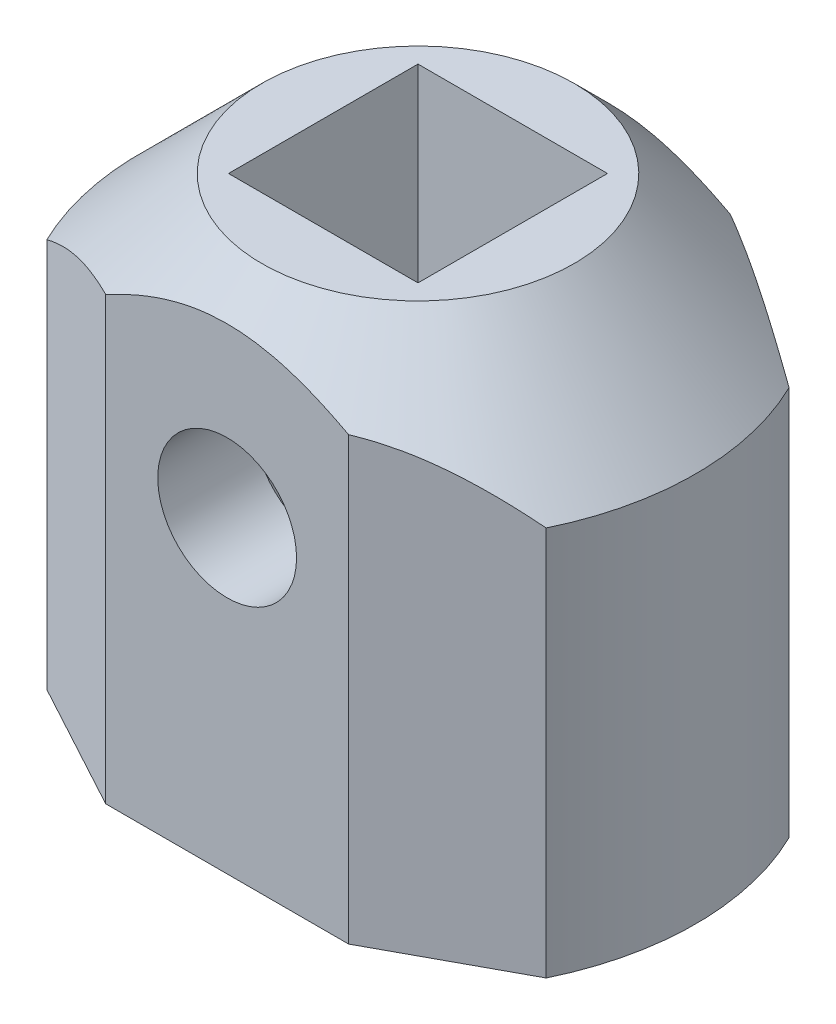
from build123d import *

# Parameters (mm, degrees)
CUT_EXTRUDE4_DEPTH      = 38.150064549
CUT_EXTRUDE5_DEPTH      = 36.286361331
CUT_EXTRUDE5_DEPTH_BACK = 36.286361331
SKETCH3_R               = 4
SKETCH4_W               = 10.922
SKETCH4_H               = 10.922
CUT_EXTRUDE6_DEPTH      = 36.286361446


with BuildPart() as part:
    # Sketch1 → Revolve1 (revolve)
    with BuildSketch(Plane.XY, mode=Mode.PRIVATE) as revolve1_sk:
        Polygon((9, 29.464), (16, 22.464), (16, 0), (4.925, 0), (4.925, 29.464), align=None)
    revolve(revolve1_sk.sketch.rotate(Axis((0, 0, 0), (0, 1, 0)), 90), axis=Axis((0, 0, 0), (0, 1, 0)))

    # Sketch2 → Cut-Extrude4 (cut, through all)
    with BuildSketch(Plane(origin=(0, 0, 0), x_dir=(1, 0, 0), z_dir=(0, 1, 0))):
        with BuildLine():
            Line((7, 11), (14.38749457, 7))
            ThreePointArc((14.38749457, 7), (0, 16), (-14.38749457, 7))
            Line((-14.38749457, 7), (-7, 11))
            Line((-7, 11), (7, 11))
        make_face()
        with BuildLine():
            ThreePointArc((14.38749457, -7), (0, -16), (-14.38749457, -7))
            Line((-14.38749457, -7), (-7, -11))
            Line((-7, -11), (7, -11))
            Line((7, -11), (14.38749457, -7))
        make_face()
    extrude(amount=CUT_EXTRUDE4_DEPTH, mode=Mode.SUBTRACT)

    # Sketch3 → Cut-Extrude5 (cut, two sides: drawn at the far end of the back side and taken through both)
    with BuildSketch(Plane.XY.offset(-CUT_EXTRUDE5_DEPTH_BACK)):
        with Locations((0, 17.78)):
            Circle(SKETCH3_R)
    extrude(amount=CUT_EXTRUDE5_DEPTH + CUT_EXTRUDE5_DEPTH_BACK, mode=Mode.SUBTRACT)

    # Sketch4 → Cut-Extrude6 (cut, through all)
    with BuildSketch(Plane.XZ):
        Rectangle(SKETCH4_W, SKETCH4_H)
    extrude(amount=-CUT_EXTRUDE6_DEPTH, mode=Mode.SUBTRACT)


solid = part.part
